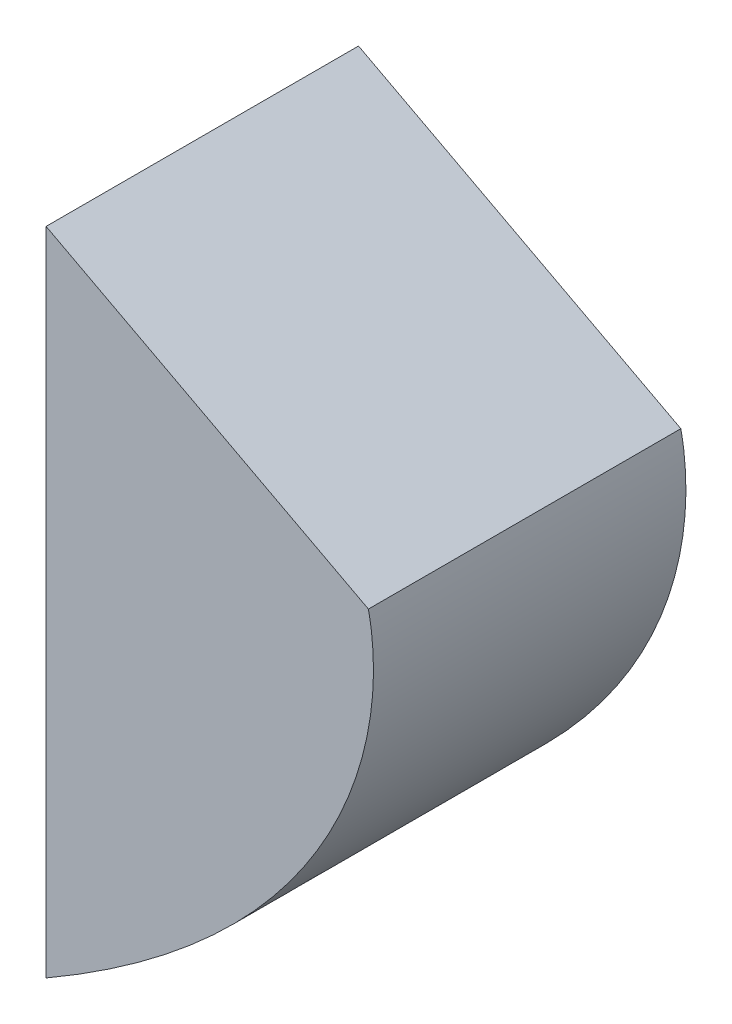
from build123d import *

# Parameters (mm, degrees)
Y_KSEKLIK_EKSTR_ZYON2_DEPTH   = 240
Y_KSEKLIK_EKSTR_ZYON2_2_DEPTH = 240
G_VDE_TA_KOPYALA2_ANGLE       = 7
G_VDE_TA_KOPYALA3_ANGLE       = 4
UST_DELIK_D                   = 10.5
UST_DELIK_DEPTH               = 10
UST_DELIK_TIP                 = 2.67500861
ALT_DELIK_D                   = 10.5
ALT_DELIK_DEPTH               = 10
ALT_DELIK_TIP                 = 3.15451825


with BuildPart() as part:
    # Çizim1 → Yükseklik-Ekstrüzyon2 (new body)
    with BuildSketch(Plane(origin=(-22.055999745, 28.001617244, 0), x_dir=(1, 0, 0), z_dir=(0, 0, 1))):
        with BuildLine():
            Line((-37.082072605, 414.146244925), (-37.082072605, -85.853755075))
            add(Edge.make_bspline(
                [(210.498072668, 283.363709139), (227.474964457, 205.264694355), (196.969150445, 49.42864807), (-37.082072605, -85.853755075)],
                knots=[0, 0, 0, 0, 1, 1, 1, 1], degree=3))
            Line((210.498072668, 283.363709139), (-37.082072605, 414.146244925))
        make_face()
    extrude(amount=Y_KSEKLIK_EKSTR_ZYON2_DEPTH)

    # ust delik
    with Locations(Plane(origin=(-59.13807235, 362.147862169, 120), x_dir=(0, 0, -1), z_dir=(-1, 0, 0))):
        with Locations((0, 0)):
            Hole(UST_DELIK_D / 2, depth=UST_DELIK_DEPTH)
            with Locations((0, 0, -(UST_DELIK_DEPTH + UST_DELIK_TIP / 2))):  # 126° drill point
                Cone(0, UST_DELIK_D / 2, UST_DELIK_TIP, mode=Mode.SUBTRACT)

    # alt delik
    with Locations(Plane(origin=(-59.13807235, 22.384202905, 120), x_dir=(0, -1, 0), z_dir=(-1, 0, 0))):
        with Locations((0, 0)):
            Hole(ALT_DELIK_D / 2, depth=ALT_DELIK_DEPTH)
            with Locations((0, 0, -(ALT_DELIK_DEPTH + ALT_DELIK_TIP / 2))):  # 118° drill point
                Cone(0, ALT_DELIK_D / 2, ALT_DELIK_TIP, mode=Mode.SUBTRACT)


with BuildPart() as body_2:
    # Çizim1 → Y_kseklik-Ekstr_zyon2 2 (new body)
    with BuildSketch(Plane(origin=(-22.055999745, 28.001617244, 0), x_dir=(1, 0, 0), z_dir=(0, 0, 1))):
        with BuildLine():
            Line((15.715679649, 483.77831526), (256.375268542, 340.659615315))
            add(Edge.make_bspline(
                [(15.715679649, 483.77831526), (225.582543856, 567.943211332), (256.375268542, 340.659615315)],
                knots=[0, 0, 0, 1, 1, 1], degree=2))
        make_face()
    extrude(amount=Y_KSEKLIK_EKSTR_ZYON2_2_DEPTH)


with BuildPart() as body_2_1:
    # Gövde-Taşı/Kopyala1: moved
    add(body_2.part.moved(Location((-44.412942898, -54.698045463, 0))))


with BuildPart() as body_2_2:
    # Gövde-Taşı/Kopyala2: moved
    add(body_2_1.part.rotate(Axis((69.576531453, 406.563761086, 0), (0, 0, 1)), G_VDE_TA_KOPYALA2_ANGLE))


with BuildPart() as body_2_3:
    # Gövde-Taşı/Kopyala3: moved
    add(body_2_2.part.rotate(Axis((72.140811609, 412.957845322, 0), (0, 0, -1)), G_VDE_TA_KOPYALA3_ANGLE))


with BuildPart() as body_2_4:
    # Gövde-Taşı/Kopyala4: moved
    add(body_2_3.part.moved(Location((0, -9.817597904, 0))))


with BuildPart() as body_2_5:
    # Gövde-Taşı/Kopyala5: moved
    add(body_2_4.part.moved(Location((-8.88258858, 0, 0))))


with BuildPart() as body_2_6:
    # Gövde-Taşı/Kopyala6: moved
    add(body_2_5.part.moved(Location((3.740037297, 1.870018648, 0))))


solid = part.part
